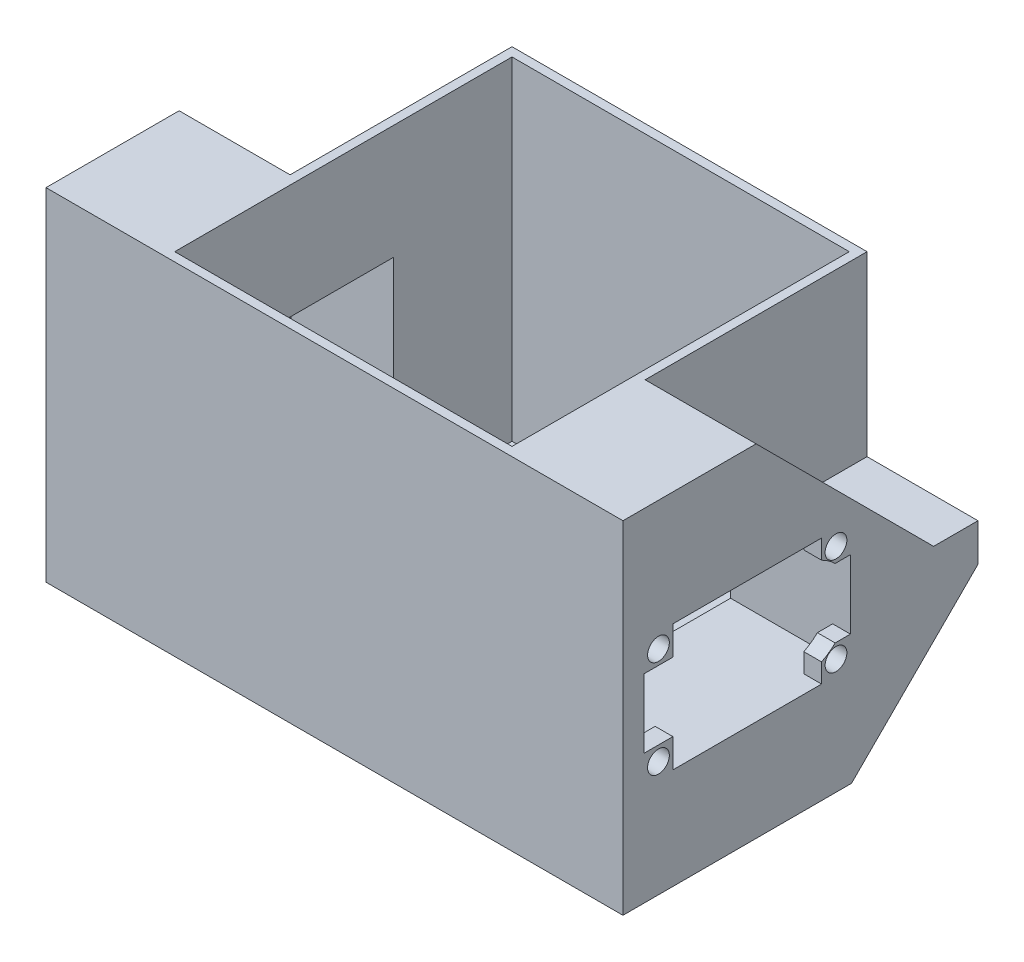
from build123d import *

# Parameters (mm, degrees)
SKETCH1_W               = 80
SKETCH1_H               = 80
SKETCH1_R               = 18.4
BOSS_EXTRUDE1_DEPTH     = 2
SKETCH2_W               = 4
SKETCH2_H               = 18.5
BOSS_EXTRUDE2_DEPTH     = 15.25
SKETCH3_R               = 2.2
CUT_EXTRUDE1_DEPTH      = 94.976393312
MIRROR2_COPY_1_SKETCH_W = 4
MIRROR2_COPY_1_SKETCH_H = 18.5
MIRROR2_COPY_1_DEPTH    = 15.25
MIRROR2_COPY_2_SKETCH_R = 2.2
MIRROR2_COPY_2_DEPTH    = 94.976393312
SKETCH4_R               = 2.2
CUT_EXTRUDE2_DEPTH      = 62.388618652
SKETCH5_W               = 4
SKETCH5_H               = 15.25
CUT_EXTRUDE3_DEPTH      = 93.258129723
SKETCH6_W               = 80
SKETCH6_H               = 80
SKETCH6_W_2             = 76
SKETCH6_H_2             = 76
BOSS_EXTRUDE3_DEPTH     = 75
SKETCH7_W               = 25
SKETCH7_H               = 77
BOSS_EXTRUDE4_DEPTH     = 80
CUT_EXTRUDE5_DEPTH      = 21
SKETCH11_W              = 25
SKETCH11_H              = 40
CUT_EXTRUDE6_DEPTH      = 50
BOSS_EXTRUDE5_DEPTH     = 25
SKETCH14_W              = 46.5
SKETCH14_H              = 28.5
SKETCH14_R              = 10.25
CUT_EXTRUDE9_DEPTH      = 34
SKETCH15_W              = 6.5
SKETCH15_H              = 6.5
SKETCH15_R              = 2.45
BOSS_EXTRUDE6_DEPTH     = 4


with BuildPart() as part:
    # Sketch1 → Boss-Extrude1 (new body)
    with BuildSketch(Plane(origin=(0, 0, 0), x_dir=(1, 0, 0), z_dir=(0, 1, 0))):
        Rectangle(SKETCH1_W, SKETCH1_H)
        with Locations(Location((0, 0, 0), (0, 0, 270))):
            Circle(SKETCH1_R, mode=Mode.SUBTRACT)
    extrude(amount=BOSS_EXTRUDE1_DEPTH)

    # Sketch2 → Boss-Extrude2 (add)
    with BuildSketch(Plane(origin=(0, 2, 0), x_dir=(1, 0, 0), z_dir=(0, 1, 0))):
        with Locations((42, -30.75)):
            Rectangle(SKETCH2_W, SKETCH2_H)
    boss_extrude2 = extrude(amount=-BOSS_EXTRUDE2_DEPTH)

    # Sketch3 → Cut-Extrude1 (cut, through all)
    with BuildSketch(Plane(origin=(44, 0, 0), x_dir=(0, 0, -1), z_dir=(1, 0, 0))):
        with Locations((-30.75, -8.125)):
            Circle(SKETCH3_R)
    cut_extrude1 = extrude(amount=-CUT_EXTRUDE1_DEPTH, mode=Mode.SUBTRACT)

    # Mirror1: Boss-Extrude2, Cut-Extrude1 across plane
    add(boss_extrude2.mirror(Plane(origin=(0, 0, 0), x_dir=(0, 0, 1), z_dir=(1, 0, 0))))
    add(cut_extrude1.mirror(Plane(origin=(0, 0, 0), x_dir=(0, 0, 1), z_dir=(1, 0, 0))), mode=Mode.SUBTRACT)

    # Mirror2: Boss-Extrude2, Cut-Extrude1 across plane
    add(boss_extrude2.mirror(Plane(origin=(0, 0, 0), x_dir=(1, 0, 0), z_dir=(0, 0, -1))))
    add(cut_extrude1.mirror(Plane(origin=(0, 0, 0), x_dir=(1, 0, 0), z_dir=(0, 0, -1))), mode=Mode.SUBTRACT)

    # Mirror2 copy 1 sketch → Mirror2 copy 1 (add)
    with BuildSketch(Plane(origin=(0, 2, 0), x_dir=(-1, 0, 0), z_dir=(0, 1, 0))):
        with Locations((42, -30.75)):
            Rectangle(MIRROR2_COPY_1_SKETCH_W, MIRROR2_COPY_1_SKETCH_H)
    extrude(amount=-MIRROR2_COPY_1_DEPTH)

    # Mirror2 copy 2 sketch → Mirror2 copy 2 (cut, through all)
    with BuildSketch(Plane.ZY.offset(44)):
        with Locations((-30.75, -8.125)):
            Circle(MIRROR2_COPY_2_SKETCH_R)
    extrude(amount=-MIRROR2_COPY_2_DEPTH, mode=Mode.SUBTRACT)

    # Sketch4 → Cut-Extrude2 (cut, through all)
    with BuildSketch(Plane(origin=(0, 2, 0), x_dir=(1, 0, 0), z_dir=(0, 1, 0))):
        with Locations(Location((-24, 24, 0), (0, 0, 270))):
            Circle(SKETCH4_R)
        with Locations(Location((24, 24, 0), (0, 0, 270))):
            Circle(SKETCH4_R)
    cut_extrude2 = extrude(amount=-CUT_EXTRUDE2_DEPTH, mode=Mode.SUBTRACT)

    # Mirror3: Cut-Extrude2 across plane
    add(cut_extrude2.mirror(Plane(origin=(0, 0, 0), x_dir=(1, 0, 0), z_dir=(0, 0, -1))), mode=Mode.SUBTRACT)

    # Sketch5 → Cut-Extrude3 (cut, through all)
    with BuildSketch(Plane.XY.offset(40)):
        with Locations((-42, -5.625)):
            Rectangle(SKETCH5_W, SKETCH5_H)
        with Locations((42, -5.625)):
            Rectangle(SKETCH5_W, SKETCH5_H)
    extrude(amount=-CUT_EXTRUDE3_DEPTH, mode=Mode.SUBTRACT)

    # Sketch6 → Boss-Extrude3 (add)
    with BuildSketch(Plane(origin=(0, 2, 0), x_dir=(1, 0, 0), z_dir=(0, 1, 0))):
        Rectangle(SKETCH6_W, SKETCH6_H)
        Rectangle(SKETCH6_W_2, SKETCH6_H_2, mode=Mode.SUBTRACT)
    extrude(amount=BOSS_EXTRUDE3_DEPTH)

    # Sketch7 → Boss-Extrude4 (add)
    with BuildSketch(Plane.XY.offset(40)):
        with Locations((-52.5, 38.5)):
            Rectangle(SKETCH7_W, SKETCH7_H)
        with Locations((52.5, 38.5)):
            Rectangle(SKETCH7_W, SKETCH7_H)
    extrude(amount=-BOSS_EXTRUDE4_DEPTH)

    # Sketch9 → Cut-Extrude5 (cut)
    with BuildSketch(Plane(origin=(65, 0, 0), x_dir=(0, 0, -1), z_dir=(1, 0, 0))):
        Polygon((40, 0), (40, 28.5), (11.5, 0), align=None)
    cut_extrude5 = extrude(amount=-CUT_EXTRUDE5_DEPTH, mode=Mode.SUBTRACT)

    # Mirror4: Cut-Extrude5 across plane
    add(cut_extrude5.mirror(Plane(origin=(0, 0, 0), x_dir=(0, 0, 1), z_dir=(1, 0, 0))), mode=Mode.SUBTRACT)

    # Sketch11 → Cut-Extrude6 (cut)
    with BuildSketch(Plane(origin=(0, 0, -40), x_dir=(-1, 0, 0), z_dir=(0, 0, -1))):
        with Locations((-52.5, 57)):
            Rectangle(SKETCH11_W, SKETCH11_H)
        with Locations((52.5, 57)):
            Rectangle(SKETCH11_W, SKETCH11_H)
    extrude(amount=-CUT_EXTRUDE6_DEPTH, mode=Mode.SUBTRACT)

    # Sketch12 → Boss-Extrude5 (add)
    with BuildSketch(Plane(origin=(65, 0, 0), x_dir=(0, 0, -1), z_dir=(1, 0, 0))):
        Polygon((30, 37), (-10, 77), (-10, 37), align=None)
    boss_extrude5 = extrude(amount=-BOSS_EXTRUDE5_DEPTH)

    # Mirror5: Boss-Extrude5 across plane
    add(boss_extrude5.mirror(Plane(origin=(0, 0, 0), x_dir=(0, 0, 1), z_dir=(1, 0, 0))))

    # Sketch14 → Cut-Extrude9 (cut)
    # profile 1 of 2: a face of its own
    with BuildSketch(Plane(origin=(65, 0, 0), x_dir=(0, 0, -1), z_dir=(1, 0, 0))):
        with Locations((-12, 37)):
            Rectangle(SKETCH14_W, SKETCH14_H)
        with Locations((0, 37)):
            Circle(SKETCH14_R, mode=Mode.SUBTRACT)
    # profile 2 of 2: a face of its own
    with BuildSketch(Plane(origin=(65, 0, 0), x_dir=(0, 0, -1), z_dir=(1, 0, 0))):
        with Locations((0, 37)):
            Circle(SKETCH14_R)
    cut_extrude9 = extrude(amount=-CUT_EXTRUDE9_DEPTH, mode=Mode.SUBTRACT)

    # Mirror6: Cut-Extrude9 across plane
    add(cut_extrude9.mirror(Plane(origin=(0, 0, 0), x_dir=(0, 0, 1), z_dir=(1, 0, 0))), mode=Mode.SUBTRACT)

    # Sketch15 → Boss-Extrude6 (add)
    # profile 1 of 4: a face of its own
    with BuildSketch(Plane(origin=(65, 0, 0), x_dir=(0, 0, -1), z_dir=(1, 0, 0))):
        with Locations((-32, 48)):
            Rectangle(SKETCH15_W, SKETCH15_H)
        with Locations((-32, 48)):
            Circle(SKETCH15_R, mode=Mode.SUBTRACT)
    # profile 2 of 4: a face of its own
    with BuildSketch(Plane(origin=(65, 0, 0), x_dir=(0, 0, -1), z_dir=(1, 0, 0))):
        with Locations((-32, 26)):
            Rectangle(SKETCH15_W, SKETCH15_H)
        with Locations((-32, 26)):
            Circle(SKETCH15_R, mode=Mode.SUBTRACT)
    # profile 3 of 4: a face of its own
    with BuildSketch(Plane(origin=(65, 0, 0), x_dir=(0, 0, -1), z_dir=(1, 0, 0))):
        with BuildLine():
            ThreePointArc((7.806247498, 29.25), (6.371323573, 28.033047567), (4.75, 27.078432584))
            Line((4.75, 27.078432584), (4.75, 22.75))
            Line((4.75, 22.75), (11.25, 22.75))
            Line((11.25, 22.75), (11.25, 29.25))
            Line((11.25, 29.25), (7.806247498, 29.25))
        make_face()
        with Locations((8, 26)):
            Circle(SKETCH15_R, mode=Mode.SUBTRACT)
    # profile 4 of 4: a face of its own
    with BuildSketch(Plane(origin=(65, 0, 0), x_dir=(0, 0, -1), z_dir=(1, 0, 0))):
        with BuildLine():
            Line((11.25, 51.25), (4.75, 51.25))
            Line((4.75, 51.25), (4.75, 46.921567416))
            ThreePointArc((4.75, 46.921567416), (6.371323573, 45.966952433), (7.806247498, 44.75))
            Line((7.806247498, 44.75), (11.25, 44.75))
            Line((11.25, 44.75), (11.25, 51.25))
        make_face()
        with Locations((8, 48)):
            Circle(SKETCH15_R, mode=Mode.SUBTRACT)
    boss_extrude6 = extrude(amount=-BOSS_EXTRUDE6_DEPTH)

    # Mirror7: Boss-Extrude6 across plane
    add(boss_extrude6.mirror(Plane(origin=(0, 0, 0), x_dir=(0, 0, 1), z_dir=(1, 0, 0))))


solid = part.part
